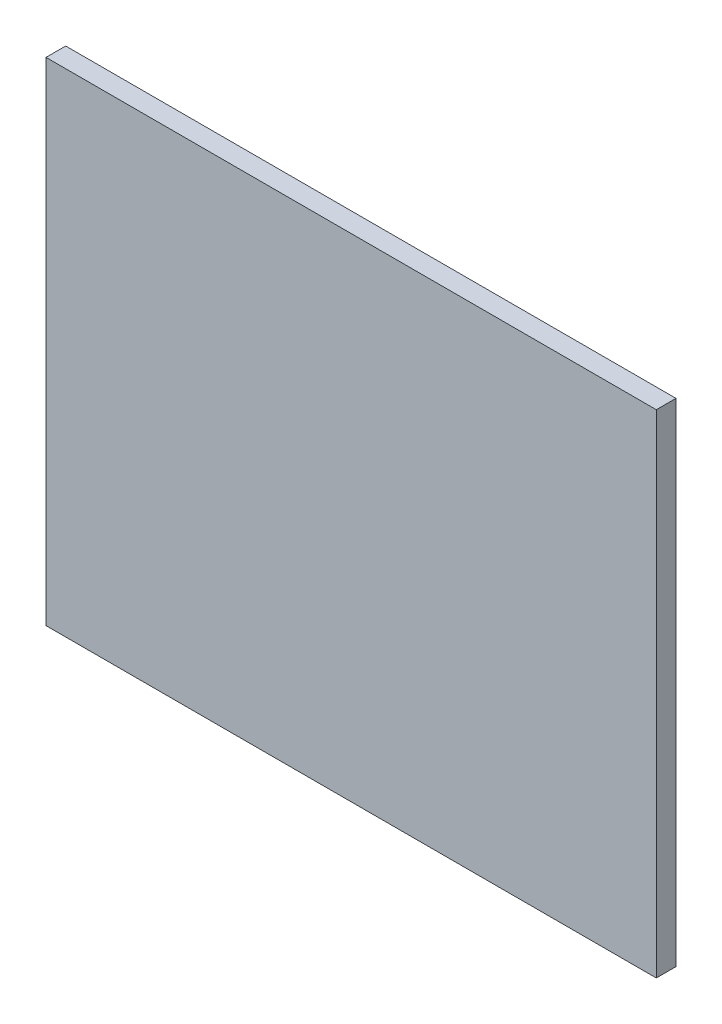
from build123d import *

# Parameters (mm, degrees)
SKETCH_1_W      = 155
SKETCH_1_H      = 125
EXTRUDE_1_DEPTH = 5


with BuildPart() as part:
    # 草图1 → 凸台-拉伸1 (new body)
    with BuildSketch(Plane.XY):
        with Locations((77.5, 62.5)):
            Rectangle(SKETCH_1_W, SKETCH_1_H)
    extrude(amount=EXTRUDE_1_DEPTH)


solid = part.part
